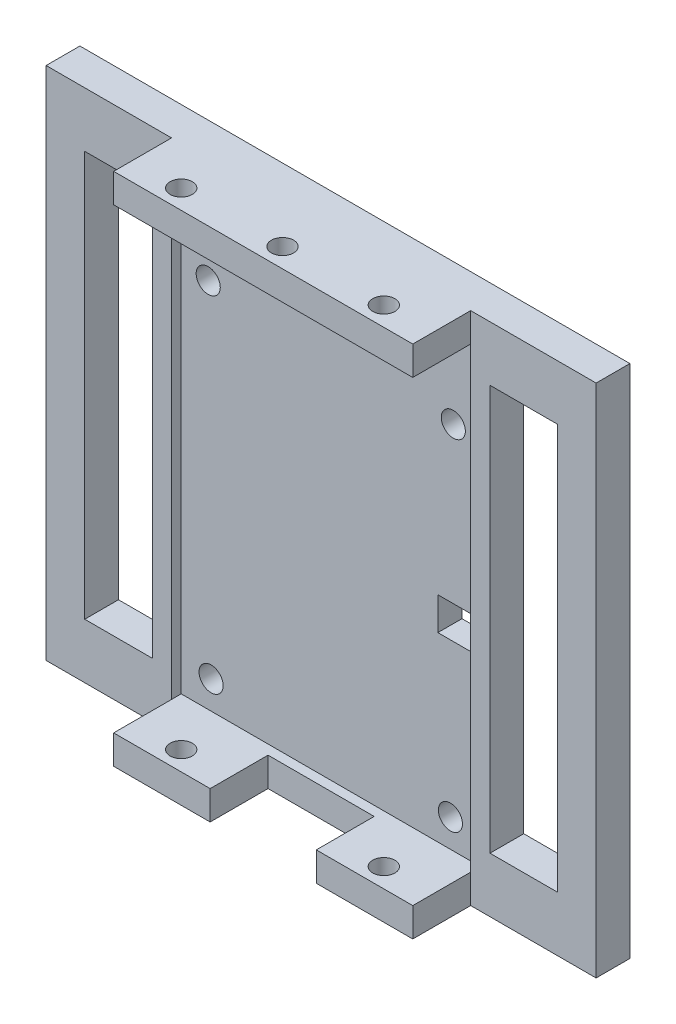
from build123d import *

# Parameters (mm, degrees)
SKETCH_1_W          = 57
SKETCH_1_H          = 51
SKETCH_1_W_2        = 3.4
SKETCH_1_H_2        = 3.4
SKETCH_1_W_3        = 7
SKETCH_1_H_3        = 42
EXTRUDE_1_DEPTH     = 3
SKETCH_2_W          = 31
SKETCH_2_H          = 47
CUT_EXTRUDE_1_DEPTH = 1
SKETCH_3_R          = 1.25
CUT_EXTRUDE_2_DEPTH = 42.060930335
SKETCH_5_W          = 57
SKETCH_5_H          = 3
EXTRUDE_2_DEPTH     = 1
SKETCH_6_W          = 57
SKETCH_6_H          = 3
EXTRUDE_3_DEPTH     = 1
SKETCH_7_W          = 10
SKETCH_7_H          = 3
EXTRUDE_4_DEPTH     = 6
SKETCH_8_W          = 31
SKETCH_8_H          = 3
EXTRUDE_5_DEPTH     = 6
CUT_EXTRUDE_3_REACH = 63.082
SKETCH_9_R          = 1.15
CUT_EXTRUDE_4_REACH = 63.082
SKETCH_10_R         = 1.15
SKETCH_12_W         = 57
SKETCH_12_H         = 53
SKETCH_12_R         = 1.25
SKETCH_12_W_2       = 3.4
SKETCH_12_H_2       = 3.4
SKETCH_12_W_3       = 7
SKETCH_12_H_3       = 42
EXTRUDE_6_DEPTH     = 0.5
EXTRUDE_START       = 0.2
SKETCH_13_R         = 1.15
EXTRUDE_7_DEPTH     = 0.2
SKETCH_14_R         = 1.15
EXTRUDE_8_DEPTH     = 0.2
SKETCH_15_R         = 1.15
CUT_EXTRUDE_5_DEPTH = 0.2
CUT_EXTRUDE_START   = -0.2
SKETCH_16_R         = 1.15
CUT_EXTRUDE_6_DEPTH = 0.2


with BuildPart() as part:
    # 草图1 → 凸台-拉伸1 (new body)
    with BuildSketch(Plane.XY):
        with Locations((0.5, 3.5)):
            Rectangle(SKETCH_1_W, SKETCH_1_H)
        with Locations((13.3, 0.3)):
            Rectangle(SKETCH_1_W_2, SKETCH_1_H_2, mode=Mode.SUBTRACT)
        with Locations((21.5, 3.5)):
            Rectangle(SKETCH_1_W_3, SKETCH_1_H_3, mode=Mode.SUBTRACT)
        with Locations((-20.5, 3.5)):
            Rectangle(SKETCH_1_W_3, SKETCH_1_H_3, mode=Mode.SUBTRACT)
    extrude(amount=EXTRUDE_1_DEPTH)

    # 草图2 → 切除-拉伸1 (cut)
    with BuildSketch(Plane.XY.offset(3)):
        with Locations((0.5, 3.5)):
            Rectangle(SKETCH_2_W, SKETCH_2_H)
    extrude(amount=-CUT_EXTRUDE_1_DEPTH, mode=Mode.SUBTRACT)

    # 草图3 → 切除-拉伸2 (cut, through all)
    with BuildSketch(Plane.XY.offset(2)):
        with Locations((-12.2, 18.3)):
            Circle(SKETCH_3_R)
        with Locations((13.2, 18.1)):
            Circle(SKETCH_3_R)
        with Locations((12.9, -17.3)):
            Circle(SKETCH_3_R)
        with Locations((-11.9, -17.3)):
            Circle(SKETCH_3_R)
    extrude(amount=-CUT_EXTRUDE_2_DEPTH, mode=Mode.SUBTRACT)

    # 草图5 → 凸台-拉伸2 (add)
    with BuildSketch(Plane(origin=(0, 29, 0), x_dir=(1, 0, 0), z_dir=(0, 1, 0))):
        with Locations((0.5, -1.5)):
            Rectangle(SKETCH_5_W, SKETCH_5_H)
    extrude(amount=EXTRUDE_2_DEPTH)

    # 草图6 → 凸台-拉伸3 (add)
    with BuildSketch(Plane(origin=(0, -22, 0), x_dir=(-1, 0, 0), z_dir=(0, -1, 0))):
        with Locations((-0.5, -1.5)):
            Rectangle(SKETCH_6_W, SKETCH_6_H)
    extrude(amount=EXTRUDE_3_DEPTH)

    # 草图7 → 凸台-拉伸4 (add)
    with BuildSketch(Plane.XY.offset(3)):
        with Locations((-10, -21.5)):
            Rectangle(SKETCH_7_W, SKETCH_7_H)
        with Locations((11, -21.5)):
            Rectangle(SKETCH_7_W, SKETCH_7_H)
    extrude(amount=EXTRUDE_4_DEPTH)

    # 草图8 → 凸台-拉伸5 (add)
    with BuildSketch(Plane.XY.offset(3)):
        with Locations((0.5, 28.5)):
            Rectangle(SKETCH_8_W, SKETCH_8_H)
    extrude(amount=EXTRUDE_5_DEPTH)

    # 草图9 → 切除-拉伸3 (cut, up to next)
    with BuildSketch(Plane.XZ.offset(23), mode=Mode.PRIVATE) as cut_extrude_3_sk1:
        with Locations(Location((-10, 7, 0), (0, 0, 270))):
            Circle(SKETCH_9_R)
    cut_extrude_3_tool1 = extrude(cut_extrude_3_sk1.sketch, amount=-CUT_EXTRUDE_3_REACH, mode=Mode.PRIVATE) & part.part
    # 草图9 → 切除-拉伸3 (cut, up to next)
    with BuildSketch(Plane.XZ.offset(23), mode=Mode.PRIVATE) as cut_extrude_3_sk2:
        with Locations(Location((11, 7, 0), (0, 0, 270))):
            Circle(SKETCH_9_R)
    cut_extrude_3_tool2 = extrude(cut_extrude_3_sk2.sketch, amount=-CUT_EXTRUDE_3_REACH, mode=Mode.PRIVATE) & part.part
    add(cut_extrude_3_tool1.solids().sort_by_distance((-10, -23, 7))[0], mode=Mode.SUBTRACT)
    add(cut_extrude_3_tool2.solids().sort_by_distance((11, -23, 7))[0], mode=Mode.SUBTRACT)

    # 草图10 → 切除-拉伸4 (cut, up to next)
    with BuildSketch(Plane(origin=(0, 30, 0), x_dir=(1, 0, 0), z_dir=(0, 1, 0)), mode=Mode.PRIVATE) as cut_extrude_4_sk1:
        with Locations(Location((-10, -7, 0), (0, 0, 90))):
            Circle(SKETCH_10_R)
    cut_extrude_4_tool1 = extrude(cut_extrude_4_sk1.sketch, amount=-CUT_EXTRUDE_4_REACH, mode=Mode.PRIVATE) & part.part
    # 草图10 → 切除-拉伸4 (cut, up to next)
    with BuildSketch(Plane(origin=(0, 30, 0), x_dir=(1, 0, 0), z_dir=(0, 1, 0)), mode=Mode.PRIVATE) as cut_extrude_4_sk2:
        with Locations(Location((0.5, -7, 0), (0, 0, 270))):
            Circle(SKETCH_10_R)
    cut_extrude_4_tool2 = extrude(cut_extrude_4_sk2.sketch, amount=-CUT_EXTRUDE_4_REACH, mode=Mode.PRIVATE) & part.part
    # 草图10 → 切除-拉伸4 (cut, up to next)
    with BuildSketch(Plane(origin=(0, 30, 0), x_dir=(1, 0, 0), z_dir=(0, 1, 0)), mode=Mode.PRIVATE) as cut_extrude_4_sk3:
        with Locations(Location((11, -7, 0), (0, 0, 90))):
            Circle(SKETCH_10_R)
    cut_extrude_4_tool3 = extrude(cut_extrude_4_sk3.sketch, amount=-CUT_EXTRUDE_4_REACH, mode=Mode.PRIVATE) & part.part
    add(cut_extrude_4_tool1.solids().sort_by_distance((-10, 30, 7))[0], mode=Mode.SUBTRACT)
    add(cut_extrude_4_tool2.solids().sort_by_distance((0.5, 30, 7))[0], mode=Mode.SUBTRACT)
    add(cut_extrude_4_tool3.solids().sort_by_distance((11, 30, 7))[0], mode=Mode.SUBTRACT)

    # 草图12 → 凸台-拉伸6 (add)
    with BuildSketch(Plane(origin=(0, 0, 0), x_dir=(-1, 0, 0), z_dir=(0, 0, -1))):
        with Locations((-0.5, 3.5)):
            Rectangle(SKETCH_12_W, SKETCH_12_H)
        with Locations(Location((-12.9, -17.3, 0), (0, 0, 180))):
            Circle(SKETCH_12_R, mode=Mode.SUBTRACT)
        with Locations(Location((12.2, 18.3, 0), (0, 0, 180))):
            Circle(SKETCH_12_R, mode=Mode.SUBTRACT)
        with Locations(Location((-13.2, 18.1, 0), (0, 0, 180))):
            Circle(SKETCH_12_R, mode=Mode.SUBTRACT)
        with Locations(Location((11.9, -17.3, 0), (0, 0, 180))):
            Circle(SKETCH_12_R, mode=Mode.SUBTRACT)
        with Locations((-13.3, 0.3)):
            Rectangle(SKETCH_12_W_2, SKETCH_12_H_2, mode=Mode.SUBTRACT)
        with Locations((20.5, 3.5)):
            Rectangle(SKETCH_12_W_3, SKETCH_12_H_3, mode=Mode.SUBTRACT)
        with Locations((-21.5, 3.5)):
            Rectangle(SKETCH_12_W_3, SKETCH_12_H_3, mode=Mode.SUBTRACT)
    extrude(amount=EXTRUDE_6_DEPTH)

    # 草图13 → 凸台-拉伸7 (add)
    with BuildSketch(Plane(origin=(0, 30, 0), x_dir=(1, 0, 0), z_dir=(0, 1, 0)).offset(EXTRUDE_START)):
        Polygon((16, -3), (29, -3), (29, 0.5), (-28, 0.5), (-28, -3), (-15, -3), (-15, -9), (16, -9), align=None)
        with Locations(Location((0.5, -7, 0), (0, 0, 270))):
            Circle(SKETCH_13_R, mode=Mode.SUBTRACT)
        with Locations(Location((11, -7, 0), (0, 0, 90))):
            Circle(SKETCH_13_R, mode=Mode.SUBTRACT)
        with Locations(Location((-10, -7, 0), (0, 0, 90))):
            Circle(SKETCH_13_R, mode=Mode.SUBTRACT)
    extrude(amount=-EXTRUDE_7_DEPTH)

    # 草图14 → 凸台-拉伸8 (add)
    with BuildSketch(Plane(origin=(0, -23, 0), x_dir=(-1, 0, 0), z_dir=(0, -1, 0))):
        Polygon((-29, 0.5), (-29, -3), (-16, -3), (-16, -9), (-6, -9), (-6, -3), (5, -3), (5, -9), (15, -9), (15, -3), (28, -3), (28, 0.5), align=None)
        with Locations(Location((-11, -7, 0), (0, 0, 90))):
            Circle(SKETCH_14_R, mode=Mode.SUBTRACT)
        with Locations(Location((10, -7, 0), (0, 0, 90))):
            Circle(SKETCH_14_R, mode=Mode.SUBTRACT)
    extrude(amount=EXTRUDE_8_DEPTH)

    # 草图15 → 切除-拉伸5 (cut)
    with BuildSketch(Plane(origin=(0, -20, 0), x_dir=(1, 0, 0), z_dir=(0, 1, 0))):
        Polygon((16, -2), (-15, -2), (-15, -3), (-15, -9), (-5, -9), (-5, -3), (6, -3), (6, -9), (16, -9), (16, -3), align=None)
        with Locations(Location((11, -7, 0), (0, 0, 90))):
            Circle(SKETCH_15_R, mode=Mode.SUBTRACT)
        with Locations(Location((-10, -7, 0), (0, 0, 90))):
            Circle(SKETCH_15_R, mode=Mode.SUBTRACT)
    extrude(amount=-CUT_EXTRUDE_5_DEPTH, mode=Mode.SUBTRACT)

    # 草图16 → 切除-拉伸6 (cut)
    with BuildSketch(Plane.XZ.offset(-27).offset(CUT_EXTRUDE_START)):
        Polygon((-15, 2), (16, 2), (16, 3), (16, 9), (-15, 9), (-15, 3), align=None)
        with Locations(Location((0.5, 7, 0), (0, 0, 90))):
            Circle(SKETCH_16_R, mode=Mode.SUBTRACT)
        with Locations(Location((11, 7, 0), (0, 0, 90))):
            Circle(SKETCH_16_R, mode=Mode.SUBTRACT)
        with Locations(Location((-10, 7, 0), (0, 0, 90))):
            Circle(SKETCH_16_R, mode=Mode.SUBTRACT)
    extrude(amount=CUT_EXTRUDE_6_DEPTH, mode=Mode.SUBTRACT)


solid = part.part
